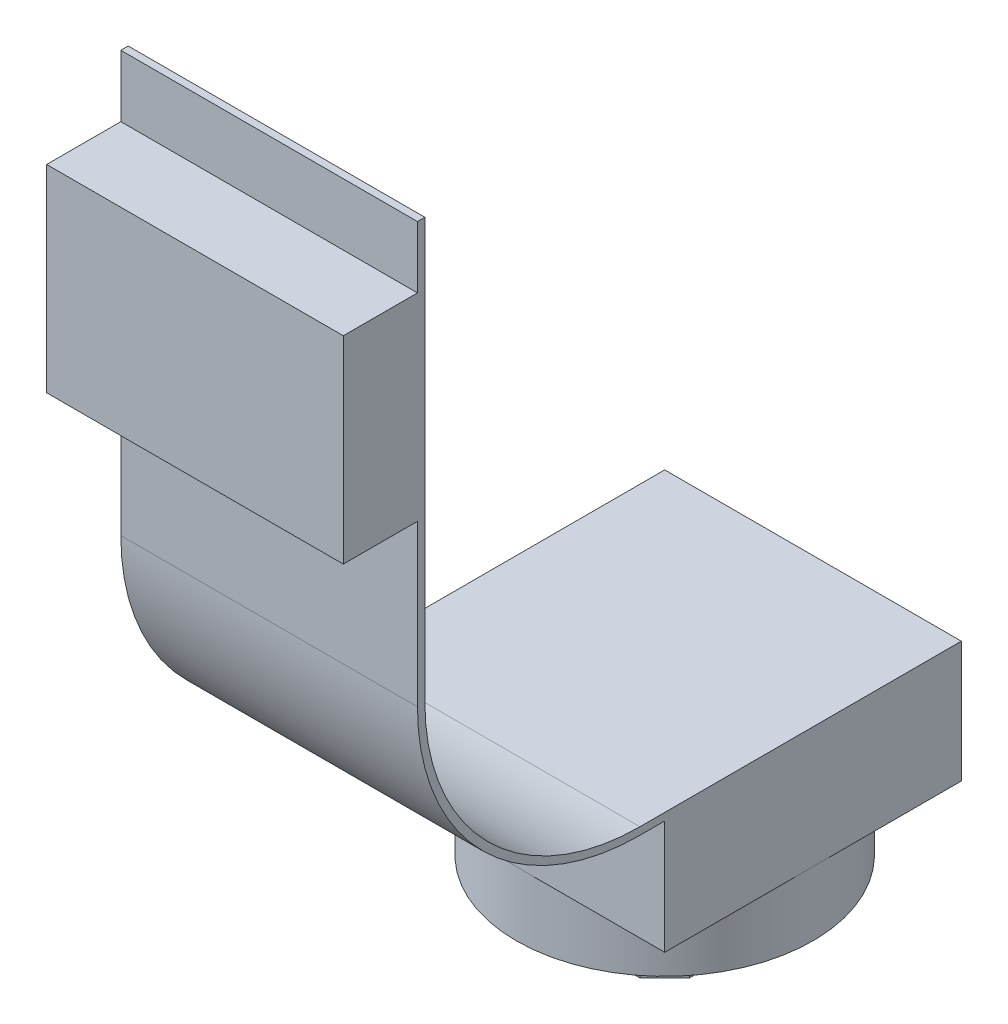
from build123d import *

# Parameters (mm, degrees)
SCHIZZO1_W                   = 15.3
SCHIZZO1_H                   = 12.5
ESTRUSIONE_ESTRUSIONE1_DEPTH = 6
SCHIZZO2_W                   = 1.5
SCHIZZO2_H                   = 1.25
TAGLIO_ESTRUSIONE1_DEPTH     = 19.055470085
SCHIZZO3_W                   = 10.85
SCHIZZO3_H                   = 12.85
TAGLIO_ESTRUSIONE2_DEPTH     = 19.055470085
SCHIZZO4_W                   = 6.5
SCHIZZO4_H                   = 2.3
TAGLIO_ESTRUSIONE3_DEPTH     = 19.055470085
SCHIZZO5_W                   = 1.5
SCHIZZO5_H                   = 7.75
TAGLIO_ESTRUSIONE4_DEPTH     = 19.055470085
ESTRUSIONE_ESTRUSIONE2_REACH = 22.139
SCHIZZO6_R                   = 3
SCHIZZO7_W                   = 4
SCHIZZO7_H                   = 4
ESTRUSIONE_ESTRUSIONE3_DEPTH = 0.4
SMUSSO1_SIZE                 = 0.5
SMUSSO2_SIZE                 = 0.5
SMUSSO3_SIZE                 = 0.5
SMUSSO4_SIZE                 = 0.5
RACCORDO1_R                  = 4.35
RACCORDO2_R                  = 4.5


with BuildPart() as part:
    # Schizzo1 → Estrusione-Estrusione1 (new body)
    with BuildSketch(Plane(origin=(-3, 0, 0), x_dir=(0, -1, 0), z_dir=(-1, 0, 0))):
        with Locations((-5.35, -4.75)):
            Rectangle(SCHIZZO1_W, SCHIZZO1_H)
    extrude(amount=-ESTRUSIONE_ESTRUSIONE1_DEPTH)

    # Schizzo2 → Taglio-Estrusione1 (cut, through all)
    with BuildSketch(Plane(origin=(3, 0, 0), x_dir=(0, 0, -1), z_dir=(1, 0, 0))):
        with Locations((-0.75, 12.375)):
            Rectangle(SCHIZZO2_W, SCHIZZO2_H)
    extrude(amount=-TAGLIO_ESTRUSIONE1_DEPTH, mode=Mode.SUBTRACT)

    # Schizzo3 → Taglio-Estrusione2 (cut, through all)
    with BuildSketch(Plane(origin=(3, 0, 0), x_dir=(0, 0, -1), z_dir=(1, 0, 0))):
        with Locations((5.575, 6.575)):
            Rectangle(SCHIZZO3_W, SCHIZZO3_H)
    extrude(amount=-TAGLIO_ESTRUSIONE2_DEPTH, mode=Mode.SUBTRACT)

    # Schizzo4 → Taglio-Estrusione3 (cut, through all)
    with BuildSketch(Plane(origin=(3, 0, 0), x_dir=(0, 0, -1), z_dir=(1, 0, 0))):
        with Locations((1.75, -1.15)):
            Rectangle(SCHIZZO4_W, SCHIZZO4_H)
    extrude(amount=-TAGLIO_ESTRUSIONE3_DEPTH, mode=Mode.SUBTRACT)

    # Schizzo5 → Taglio-Estrusione4 (cut, through all)
    with BuildSketch(Plane(origin=(3, 0, 0), x_dir=(0, 0, -1), z_dir=(1, 0, 0))):
        with Locations((-0.75, 3.875)):
            Rectangle(SCHIZZO5_W, SCHIZZO5_H)
    extrude(amount=-TAGLIO_ESTRUSIONE4_DEPTH, mode=Mode.SUBTRACT)

    # Schizzo6 → Estrusione-Estrusione2 (add, up to next)
    with BuildSketch(Plane.XZ.offset(3.6), mode=Mode.PRIVATE) as estrusione_estrusione2_sk1:
        with Locations(Location((0, -8, 0), (0, 0, 90))):
            Circle(SCHIZZO6_R)
    estrusione_estrusione2_tool1 = extrude(estrusione_estrusione2_sk1.sketch, amount=-ESTRUSIONE_ESTRUSIONE2_REACH, mode=Mode.PRIVATE) - part.part
    add(estrusione_estrusione2_tool1.solids().sort_by_distance((0, -3.6, -8))[0])

    # Schizzo7 → Estrusione-Estrusione3 (add)
    with BuildSketch(Plane.XZ.offset(3.6)):
        with Locations((0, -8)):
            Rectangle(SCHIZZO7_W, SCHIZZO7_H)
    extrude(amount=ESTRUSIONE_ESTRUSIONE3_DEPTH)

    # Smusso1
    smusso1_edges = [part.edges().sort_by_distance(p)[0] for p in [
        (-2, -3.8, -10),
    ]]
    chamfer(smusso1_edges, length=SMUSSO1_SIZE)

    # Smusso2
    smusso2_edges = [part.edges().sort_by_distance(p)[0] for p in [
        (2, -3.8, -6),
    ]]
    chamfer(smusso2_edges, length=SMUSSO2_SIZE)

    # Smusso3
    smusso3_edges = [part.edges().sort_by_distance(p)[0] for p in [
        (-2, -3.8, -6),
    ]]
    chamfer(smusso3_edges, length=SMUSSO3_SIZE)

    # Smusso4
    smusso4_edges = [part.edges().sort_by_distance(p)[0] for p in [
        (2, -3.8, -10),
    ]]
    chamfer(smusso4_edges, length=SMUSSO4_SIZE)

    # Raccordo1
    raccordo1_edges = [part.edges().sort_by_distance(p)[0] for p in [
        (0, 0.15, -0.15),
    ]]
    fillet(raccordo1_edges, radius=RACCORDO1_R)

    # Raccordo2
    raccordo2_edges = [part.edges().sort_by_distance(p)[0] for p in [
        (0, 0, 0),
    ]]
    fillet(raccordo2_edges, radius=RACCORDO2_R)


solid = part.part
